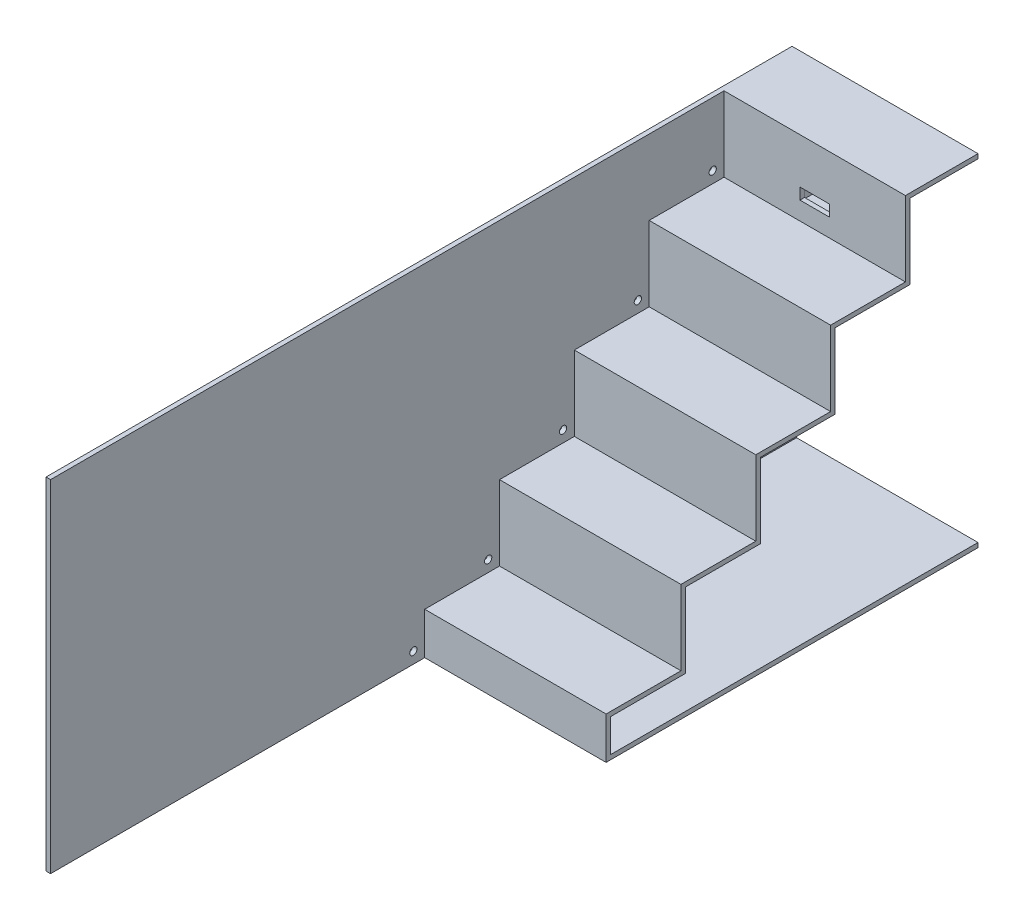
from build123d import *

# Parameters (mm, degrees)
BOSS_EXTRUDE1_DEPTH = 80
SKETCH3_W           = 299
SKETCH3_H           = 299
BOSS_EXTRUDE2_DEPTH = 2
SKETCH4_W           = 82
SKETCH4_H           = 299
BOSS_EXTRUDE3_DEPTH = 2
SKETCH6_W           = 299
SKETCH6_H           = 150.5
CUT_EXTRUDE1_DEPTH  = 82
SKETCH7_W           = 132
SKETCH7_H           = 2
BOSS_EXTRUDE4_DEPTH = 80
SKETCH8_R           = 1.6
CUT_EXTRUDE2_DEPTH  = 2
SKETCH12_W          = 13
SKETCH12_H          = 5
CUT_EXTRUDE4_DEPTH  = 2
SKETCH14_W          = 18
SKETCH14_H          = 11
SKETCH14_W_2        = 14
SKETCH14_H_2        = 7
BOSS_EXTRUDE5_DEPTH = 10
BOSS_EXTRUDE6_DEPTH = 30
SKETCH16_W          = 80
SKETCH16_H          = 2
BOSS_EXTRUDE7_DEPTH = 30


with BuildPart() as part:
    # Sketch1 → Boss-Extrude1 (new body)
    with BuildSketch(Plane(origin=(0, 0, 0), x_dir=(0, 0, -1), z_dir=(1, 0, 0))):
        Polygon((-23.931657395, -26.597399746), (-23.931657395, 6.402600254), (9.068342605, 6.402600254), (9.068342605, 39.402600254), (42.068342605, 39.402600254), (42.068342605, 72.402600254), (75.068342605, 72.402600254), (75.068342605, 105.402600254), (108.068342605, 105.402600254), (108.068342605, 138.402600254), (141.068342605, 138.402600254), (141.068342605, 171.402600254), (174.068342605, 171.402600254), (174.068342605, 204.402600254), (207.068342605, 204.402600254), (207.068342605, 237.402600254), (240.068342605, 237.402600254), (240.068342605, 272.402600254), (238.068342605, 272.402600254), (238.068342605, 239.402600254), (205.068342605, 239.402600254), (205.068342605, 206.402600254), (172.068342605, 206.402600254), (172.068342605, 173.402600254), (139.068342605, 173.402600254), (139.068342605, 140.402600254), (106.068342605, 140.402600254), (106.068342605, 107.402600254), (73.068342605, 107.402600254), (73.068342605, 74.402600254), (40.068342605, 74.402600254), (40.068342605, 41.402600254), (7.068342605, 41.402600254), (7.068342605, 8.402600254), (-25.931657395, 8.402600254), (-25.931657395, -24.597399746), (-58.931657395, -24.597399746), (-58.931657395, -26.597399746), align=None)
    extrude(amount=BOSS_EXTRUDE1_DEPTH)

    # Sketch3 → Boss-Extrude2 (add)
    with BuildSketch(Plane.ZY):
        with Locations((-90.568342605, 122.902600254)):
            Rectangle(SKETCH3_W, SKETCH3_H)
    extrude(amount=BOSS_EXTRUDE2_DEPTH)

    # Sketch4 → Boss-Extrude3 (add)
    with BuildSketch(Plane.XZ.offset(26.597399746)):
        with Locations((39, -90.568342605)):
            Rectangle(SKETCH4_W, SKETCH4_H)
    extrude(amount=BOSS_EXTRUDE3_DEPTH)

    # Sketch6 → Cut-Extrude1 (cut)
    with BuildSketch(Plane.ZY.offset(2)):
        with Locations((-90.568342605, 46.652600254)):
            Rectangle(SKETCH6_W, SKETCH6_H)
    extrude(amount=-CUT_EXTRUDE1_DEPTH, mode=Mode.SUBTRACT)

    # Sketch7 → Boss-Extrude4 (add)
    with BuildSketch(Plane(origin=(0, 0, 0), x_dir=(0, 0, -1), z_dir=(1, 0, 0))):
        with Locations((174.068342605, 122.902600254)):
            Rectangle(SKETCH7_W, SKETCH7_H)
    extrude(amount=BOSS_EXTRUDE4_DEPTH)

    # Sketch8 → Cut-Extrude2 (cut)
    with BuildSketch(Plane(origin=(0, 0, 0), x_dir=(0, 0, -1), z_dir=(1, 0, 0))):
        with Locations((101.068342605, 126.902600254)):
            Circle(SKETCH8_R)
        with Locations((134.068342605, 145.402600254)):
            Circle(SKETCH8_R)
        with Locations((167.068342605, 178.402600254)):
            Circle(SKETCH8_R)
        with Locations((200.068342605, 211.402600254)):
            Circle(SKETCH8_R)
        with Locations((233.068342605, 244.402600254)):
            Circle(SKETCH8_R)
    extrude(amount=-CUT_EXTRUDE2_DEPTH, mode=Mode.SUBTRACT)

    # Sketch12 → Cut-Extrude4 (cut)
    with BuildSketch(Plane.XY.offset(-238.068342605)):
        with Locations((40, 249.902600254)):
            Rectangle(SKETCH12_W, SKETCH12_H)
    extrude(amount=-CUT_EXTRUDE4_DEPTH, mode=Mode.SUBTRACT)

    # Sketch14 → Boss-Extrude5 (add)
    with BuildSketch(Plane.XY.offset(-238.068342605)):
        with Locations((40, 249.902600254)):
            Rectangle(SKETCH14_W, SKETCH14_H)
        with Locations((40, 249.902600254)):
            Rectangle(SKETCH14_W_2, SKETCH14_H_2, mode=Mode.SUBTRACT)
    extrude(amount=-BOSS_EXTRUDE5_DEPTH)

    # Sketch15 → Boss-Extrude6 (add)
    with BuildSketch(Plane(origin=(0, 0, -240.068342605), x_dir=(-1, 0, 0), z_dir=(0, 0, -1))):
        Polygon((-80, 272.402600254), (2, 272.402600254), (2, 121.902600254), (0, 121.902600254), (0, 270.402600254), (-80, 270.402600254), align=None)
    extrude(amount=BOSS_EXTRUDE6_DEPTH)

    # Sketch16 → Boss-Extrude7 (add)
    with BuildSketch(Plane(origin=(0, 0, -240.068342605), x_dir=(-1, 0, 0), z_dir=(0, 0, -1))):
        with Locations((-40, 122.902600254)):
            Rectangle(SKETCH16_W, SKETCH16_H)
    extrude(amount=BOSS_EXTRUDE7_DEPTH)


solid = part.part
